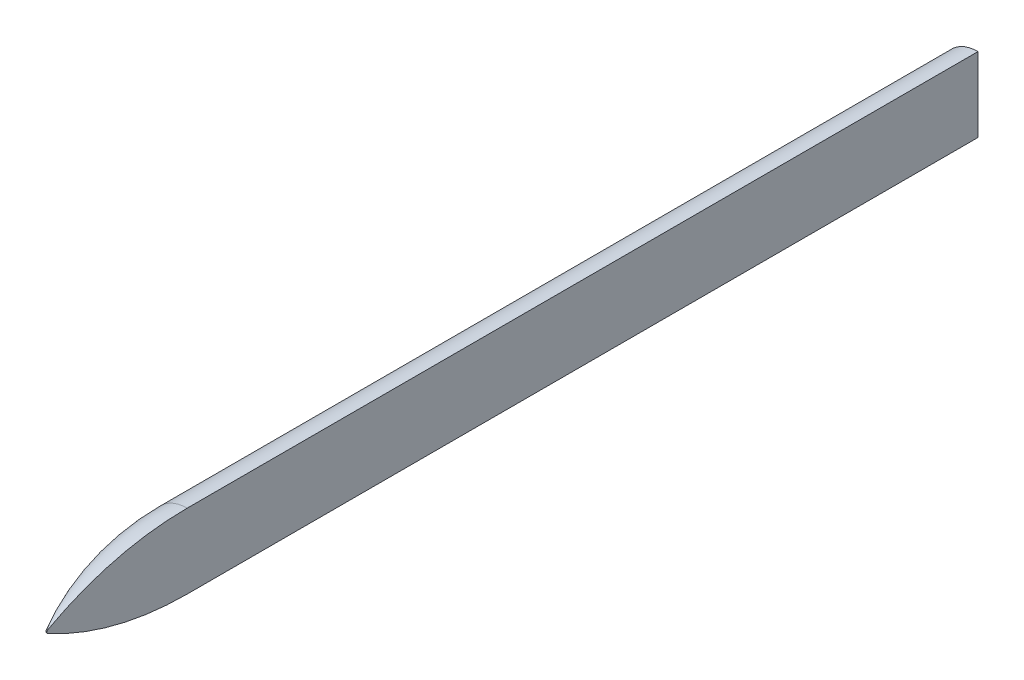
from build123d import *

# Parameters (mm, degrees)
REVOLVE1_ANGLE = 180


with BuildPart() as part:
    # Sketch1 → Revolve1 (revolve)
    with BuildSketch(Plane(origin=(0, 0, 0), x_dir=(0, 0, -1), z_dir=(1, 0, 0))):
        with BuildLine():
            Line((500, 40), (-350, 40))
            ThreePointArc((-350, 40), (-427.407937183, 30.270191823), (-500, 1.68609971))
            ThreePointArc((-500, 1.68609971), (-500.73119809, 0.980169913), (-501, 0))
            Line((-501, 0), (500, 0))
            Line((500, 0), (500, 40))
        make_face()
    revolve(axis=Axis((0, 0, 0), (0, 0, 1)), revolution_arc=REVOLVE1_ANGLE)


solid = part.part
